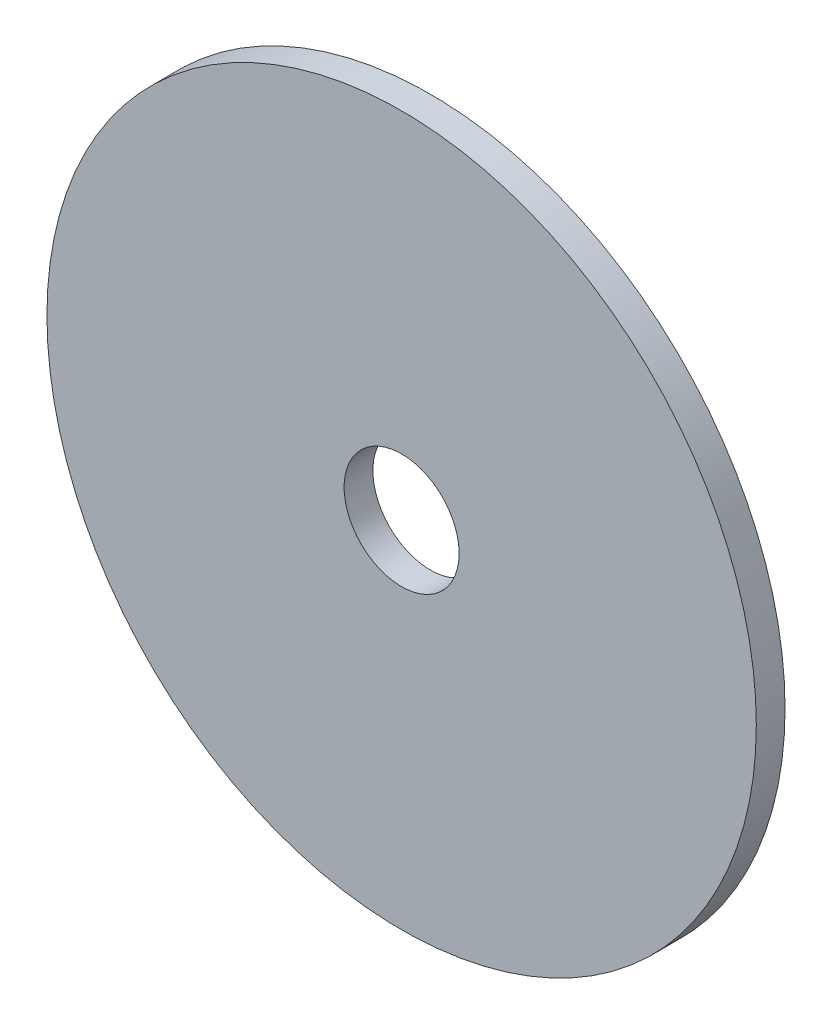
from build123d import *

# Parameters (mm, degrees)
MODEL_R             = 37
MODEL_R_2           = 6
BOSS_EXTRUDE2_DEPTH = 3


with BuildPart() as part:
    # Model → Boss-Extrude2 (new body)
    with BuildSketch(Plane.XY):
        Circle(MODEL_R)
        Circle(MODEL_R_2, mode=Mode.SUBTRACT)
    extrude(amount=BOSS_EXTRUDE2_DEPTH)


solid = part.part
